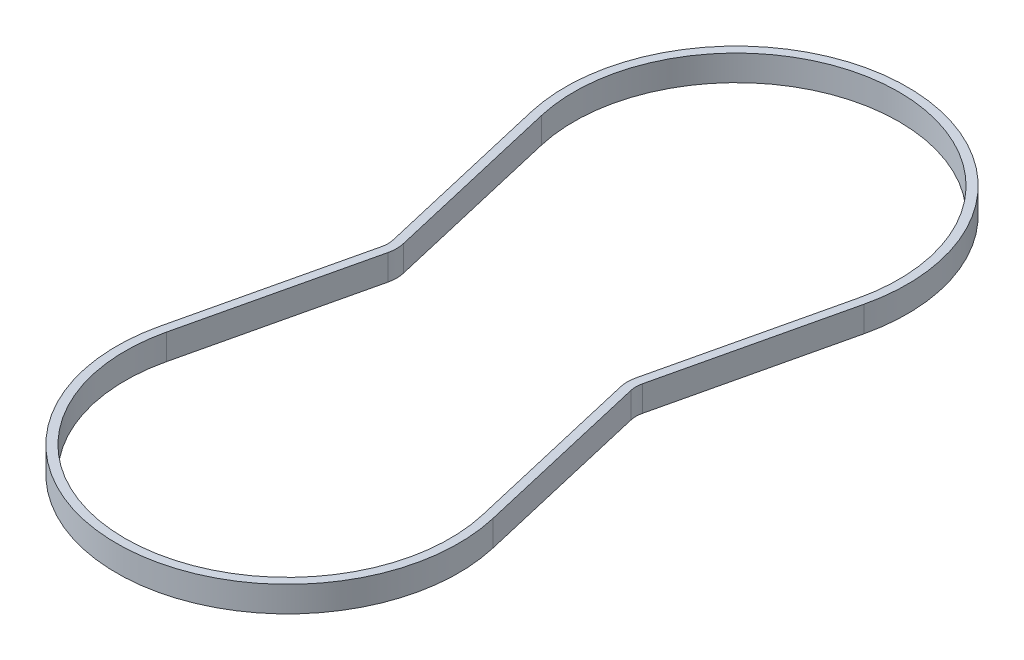
from build123d import *

# Parameters (mm, degrees)
EXTRUDE_1_DEPTH = 6


with BuildPart() as part:
    # 草图1 → 拉伸-薄壁1 (new body)
    with BuildSketch(Plane(origin=(0, 0, 0), x_dir=(1, 0, 0), z_dir=(0, 1, 0))):
        with BuildLine():
            Line((29.156511109, 1.361483597), (38.956592605, 43.423442689))
            ThreePointArc((38.956592605, 43.423442689), (0, 92.5), (-38.956592605, 43.423442689))
            Line((-38.956592605, 43.423442689), (-29.156511109, 1.361483597))
            ThreePointArc((-29.156511109, 1.361483597), (-29, 0), (-29.156511109, -1.361483597))
            Line((-29.156511109, -1.361483597), (-38.956592605, -43.423442689))
            ThreePointArc((-38.956592605, -43.423442689), (0, -92.5), (38.956592605, -43.423442689))
            Line((38.956592605, -43.423442689), (29.156511109, -1.361483597))
            ThreePointArc((29.156511109, -1.361483597), (29, 0), (29.156511109, 1.361483597))
        make_face()
        with BuildLine():
            Line((27.208681479, 1.815311462), (37.008762975, 43.877270554))
            ThreePointArc((37.008762975, 43.877270554), (0, 90.5), (-37.008762975, 43.877270554))
            Line((-37.008762975, 43.877270554), (-27.208681479, 1.815311462))
            ThreePointArc((-27.208681479, 1.815311462), (-27, 0), (-27.208681479, -1.815311462))
            Line((-27.208681479, -1.815311462), (-37.008762975, -43.877270554))
            ThreePointArc((-37.008762975, -43.877270554), (0, -90.5), (37.008762975, -43.877270554))
            Line((37.008762975, -43.877270554), (27.208681479, -1.815311462))
            ThreePointArc((27.208681479, -1.815311462), (27, 0), (27.208681479, 1.815311462))
        make_face(mode=Mode.SUBTRACT)
    extrude(amount=EXTRUDE_1_DEPTH)


solid = part.part
